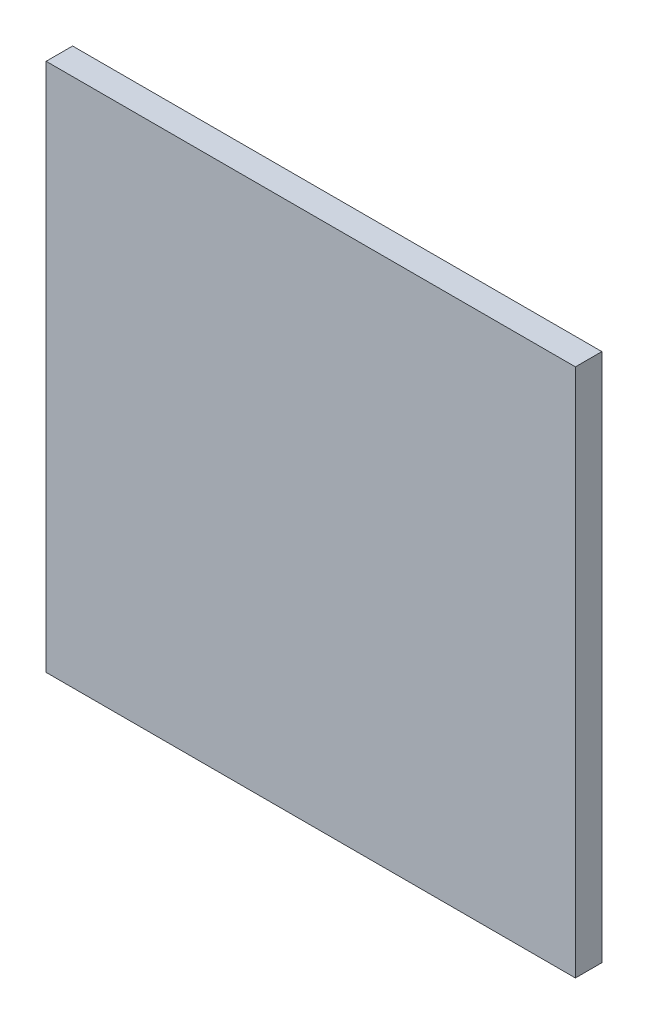
from build123d import *

# Parameters (mm, degrees)
SKETCH1_W           = 100
SKETCH1_H           = 100
BOSS_EXTRUDE1_DEPTH = 5


with BuildPart() as part:
    # Sketch1 → Boss-Extrude1 (new body)
    with BuildSketch(Plane.XY):
        Rectangle(SKETCH1_W, SKETCH1_H)
    extrude(amount=BOSS_EXTRUDE1_DEPTH)


solid = part.part
